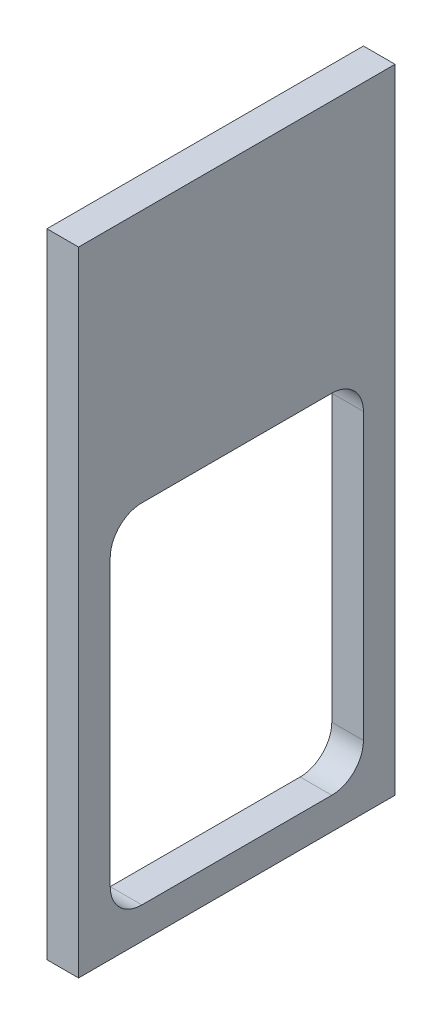
from build123d import *

# Parameters (mm, degrees)
SKETCH_1_W          = 100
SKETCH_1_H          = 200
EXTRUDE_1_DEPTH     = 10
SKETCH_2_W          = 80
SKETCH_2_H          = 110
CUT_EXTRUDE_1_DEPTH = 113.249721603
FILLET_1_R          = 10


with BuildPart() as part:
    # 草图1 → 凸台-拉伸1 (new body)
    with BuildSketch(Plane(origin=(0, 0, 0), x_dir=(0, 0, -1), z_dir=(1, 0, 0))):
        Rectangle(SKETCH_1_W, SKETCH_1_H)
    extrude(amount=EXTRUDE_1_DEPTH)

    # 草图2 → 切除-拉伸1 (cut, through all)
    with BuildSketch(Plane(origin=(10, 0, 0), x_dir=(0, 0, -1), z_dir=(1, 0, 0))):
        with Locations((0, -35)):
            Rectangle(SKETCH_2_W, SKETCH_2_H)
    extrude(amount=-CUT_EXTRUDE_1_DEPTH, mode=Mode.SUBTRACT)

    # 圆角1
    fillet_1_edges = [part.edges().sort_by_distance(p)[0] for p in [
        (5, -90, 40),
        (5, 20, 40),
        (5, 20, -40),
        (5, -90, -40),
    ]]
    fillet(fillet_1_edges, radius=FILLET_1_R)


solid = part.part
